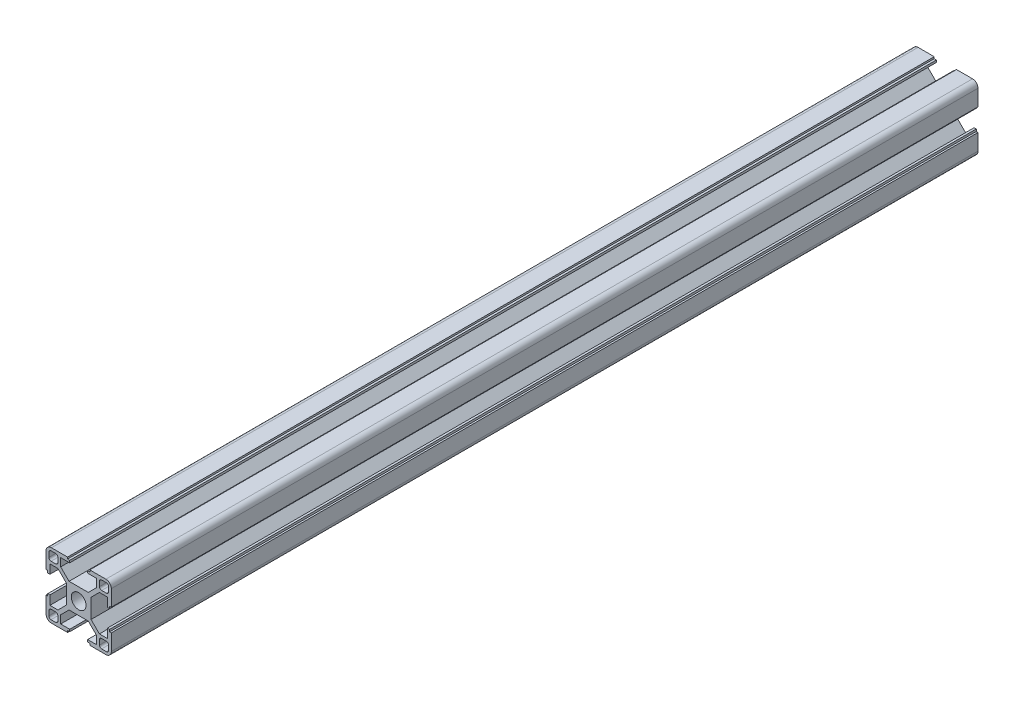
from build123d import *

# Parameters (mm, degrees)
SKETCH1_R      = 3.4
EXTRUDE1_DEPTH = 398
EXTRUDE2_DEPTH = 399.564925702


with BuildPart() as part:
    # Sketch1 → Extrude1 (new body)
    with BuildSketch(Plane.XY):
        with BuildLine():
            Line((-5.1, 14.2), (-5.1, 15))
            Line((-5.1, 15), (-12.5, 15))
            ThreePointArc((-12.5, 15), (-14.267766953, 14.267766953), (-15, 12.5))
            Line((-15, 12.5), (-15, 5.1))
            Line((-15, 5.1), (-14.2, 5.1))
            Line((-14.2, 5.1), (-14.2, 4.1))
            Line((-14.2, 4.1), (-13.2, 4.1))
            Line((-13.2, 4.1), (-13.2, 8.25))
            Line((-13.2, 8.25), (-9.522792206, 8.25))
            Line((-9.522792206, 8.25), (-5.7, 4.427207794))
            Line((-5.7, 4.427207794), (-5.7, -4.427207794))
            Line((-5.7, -4.427207794), (-9.522792206, -8.25))
            Line((-9.522792206, -8.25), (-13.2, -8.25))
            Line((-13.2, -8.25), (-13.2, -4.1))
            Line((-13.2, -4.1), (-14.2, -4.1))
            Line((-14.2, -4.1), (-14.2, -5.1))
            Line((-14.2, -5.1), (-15, -5.1))
            Line((-15, -5.1), (-15, -12.5))
            ThreePointArc((-15, -12.5), (-14.267766953, -14.267766953), (-12.5, -15))
            Line((-12.5, -15), (-5.1, -15))
            Line((-5.1, -15), (-5.1, -14.2))
            Line((-5.1, -14.2), (-4.1, -14.2))
            Line((-4.1, -14.2), (-4.1, -13.2))
            Line((-4.1, -13.2), (-8.25, -13.2))
            Line((-8.25, -13.2), (-8.25, -9.522792206))
            Line((-8.25, -9.522792206), (-4.427207794, -5.7))
            Line((-4.427207794, -5.7), (4.427207794, -5.7))
            Line((4.427207794, -5.7), (8.25, -9.522792206))
            Line((8.25, -9.522792206), (8.25, -13.2))
            Line((8.25, -13.2), (4.1, -13.2))
            Line((4.1, -13.2), (4.1, -14.2))
            Line((4.1, -14.2), (5.1, -14.2))
            Line((5.1, -14.2), (5.1, -15))
            Line((5.1, -15), (12.5, -15))
            ThreePointArc((12.5, -15), (14.267766953, -14.267766953), (15, -12.5))
            Line((15, -12.5), (15, -5.1))
            Line((15, -5.1), (14.2, -5.1))
            Line((14.2, -5.1), (14.2, -4.1))
            Line((14.2, -4.1), (13.2, -4.1))
            Line((13.2, -4.1), (13.2, -8.25))
            Line((13.2, -8.25), (9.522792206, -8.25))
            Line((9.522792206, -8.25), (5.7, -4.427207794))
            Line((5.7, -4.427207794), (5.7, 4.427207794))
            Line((5.7, 4.427207794), (9.522792206, 8.25))
            Line((9.522792206, 8.25), (13.2, 8.25))
            Line((13.2, 8.25), (13.2, 4.1))
            Line((13.2, 4.1), (14.2, 4.1))
            Line((14.2, 4.1), (14.2, 5.1))
            Line((14.2, 5.1), (15, 5.1))
            Line((15, 5.1), (15, 12.5))
            ThreePointArc((15, 12.5), (14.267766953, 14.267766953), (12.5, 15))
            Line((12.5, 15), (5.1, 15))
            Line((5.1, 15), (5.1, 14.2))
            Line((5.1, 14.2), (4.1, 14.2))
            Line((4.1, 14.2), (4.1, 13.2))
            Line((4.1, 13.2), (8.25, 13.2))
            Line((8.25, 13.2), (8.25, 9.522792206))
            Line((8.25, 9.522792206), (4.427207794, 5.7))
            Line((4.427207794, 5.7), (-4.427207794, 5.7))
            Line((-4.427207794, 5.7), (-8.25, 9.522792206))
            Line((-8.25, 9.522792206), (-8.25, 13.2))
            Line((-8.25, 13.2), (-4.1, 13.2))
            Line((-4.1, 13.2), (-4.1, 14.2))
            Line((-4.1, 14.2), (-5.1, 14.2))
        make_face()
        Circle(SKETCH1_R, mode=Mode.SUBTRACT)
    extrude(amount=EXTRUDE1_DEPTH)

    # Sketch2 → Extrude2 (cut, through all)
    with BuildSketch(Plane.XY.offset(398)):
        with BuildLine():
            Line((13.7, 12.7), (13.7, 10.55))
            ThreePointArc((13.7, 10.55), (13.407106781, 9.842893219), (12.7, 9.55))
            Line((12.7, 9.55), (10.55, 9.55))
            ThreePointArc((10.55, 9.55), (9.842893219, 9.842893219), (9.55, 10.55))
            Line((9.55, 10.55), (9.55, 12.7))
            ThreePointArc((9.55, 12.7), (9.842893219, 13.407106781), (10.55, 13.7))
            Line((10.55, 13.7), (12.7, 13.7))
            ThreePointArc((12.7, 13.7), (13.407106781, 13.407106781), (13.7, 12.7))
        make_face()
        with BuildLine():
            Line((-12.7, 13.7), (-10.55, 13.7))
            ThreePointArc((-10.55, 13.7), (-9.842893219, 13.407106781), (-9.55, 12.7))
            Line((-9.55, 12.7), (-9.55, 10.55))
            ThreePointArc((-9.55, 10.55), (-9.842893219, 9.842893219), (-10.55, 9.55))
            Line((-10.55, 9.55), (-12.7, 9.55))
            ThreePointArc((-12.7, 9.55), (-13.407106781, 9.842893219), (-13.7, 10.55))
            Line((-13.7, 10.55), (-13.7, 12.7))
            ThreePointArc((-13.7, 12.7), (-13.407106781, 13.407106781), (-12.7, 13.7))
        make_face()
        with BuildLine():
            Line((12.7, -13.7), (10.55, -13.7))
            ThreePointArc((10.55, -13.7), (9.842893219, -13.407106781), (9.55, -12.7))
            Line((9.55, -12.7), (9.55, -10.55))
            ThreePointArc((9.55, -10.55), (9.842893219, -9.842893219), (10.55, -9.55))
            Line((10.55, -9.55), (12.7, -9.55))
            ThreePointArc((12.7, -9.55), (13.407106781, -9.842893219), (13.7, -10.55))
            Line((13.7, -10.55), (13.7, -12.7))
            ThreePointArc((13.7, -12.7), (13.407106781, -13.407106781), (12.7, -13.7))
        make_face()
        with BuildLine():
            Line((-13.7, -12.7), (-13.7, -10.55))
            ThreePointArc((-13.7, -10.55), (-13.407106781, -9.842893219), (-12.7, -9.55))
            Line((-12.7, -9.55), (-10.55, -9.55))
            ThreePointArc((-10.55, -9.55), (-9.842893219, -9.842893219), (-9.55, -10.55))
            Line((-9.55, -10.55), (-9.55, -12.7))
            ThreePointArc((-9.55, -12.7), (-9.842893219, -13.407106781), (-10.55, -13.7))
            Line((-10.55, -13.7), (-12.7, -13.7))
            ThreePointArc((-12.7, -13.7), (-13.407106781, -13.407106781), (-13.7, -12.7))
        make_face()
    extrude(amount=-EXTRUDE2_DEPTH, mode=Mode.SUBTRACT)


solid = part.part
